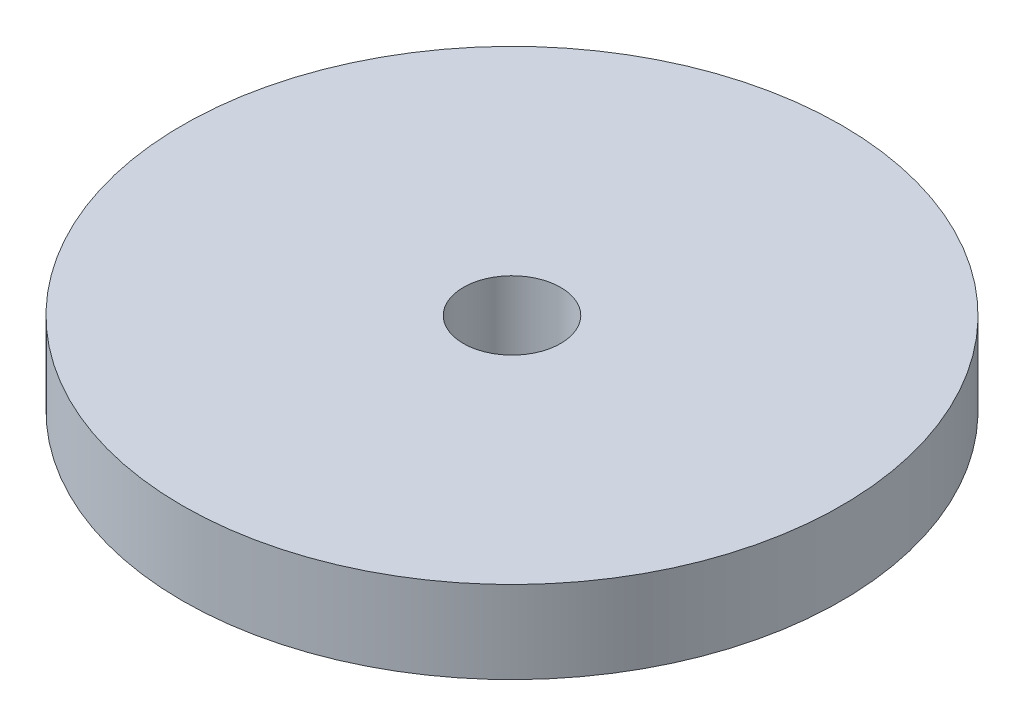
from build123d import *

# Parameters (mm, degrees)
SKETCH1_R           = 10.16
SKETCH1_R_2         = 1.5
BOSS_EXTRUDE1_DEPTH = 2.54


with BuildPart() as part:
    # Sketch1 → Boss-Extrude1 (new body)
    with BuildSketch(Plane(origin=(0, 0, 0), x_dir=(1, 0, 0), z_dir=(0, 1, 0))):
        with Locations(Location((0, 0, 0), (0, 0, 270))):
            Circle(SKETCH1_R)
        with Locations(Location((0, 0, 0), (0, 0, 270))):
            Circle(SKETCH1_R_2, mode=Mode.SUBTRACT)
    extrude(amount=BOSS_EXTRUDE1_DEPTH)


solid = part.part
